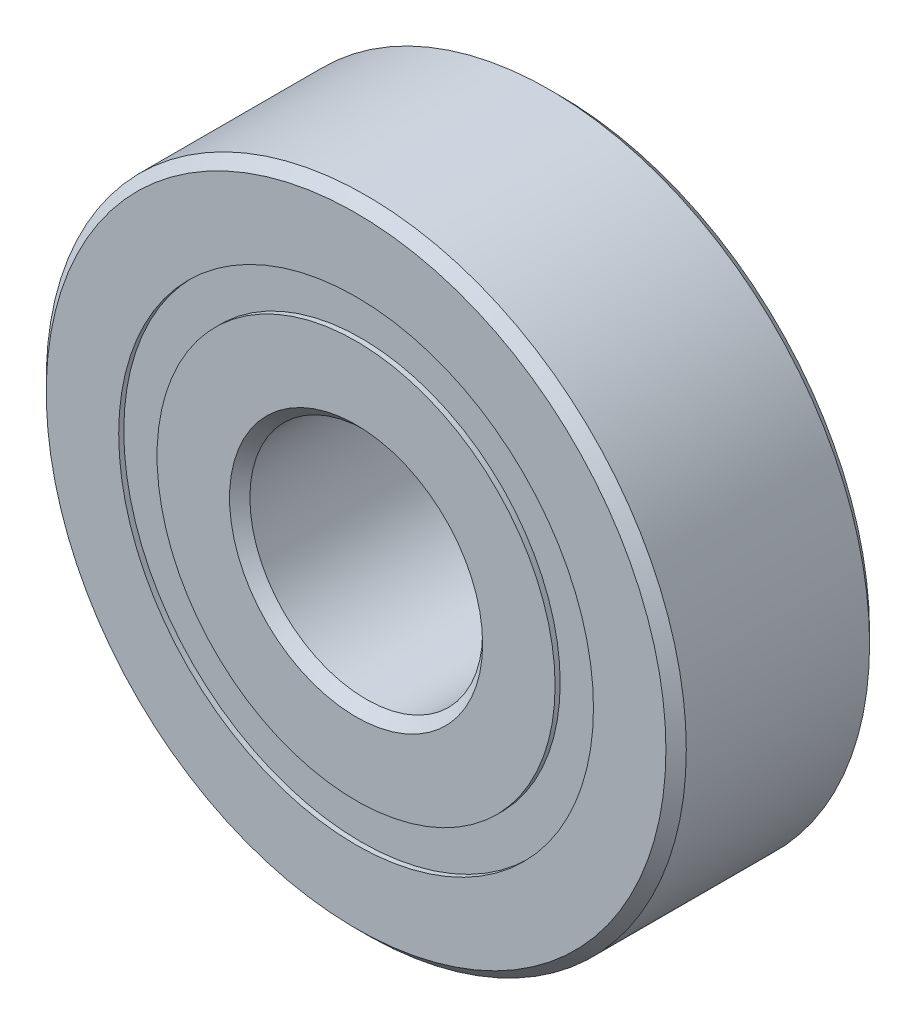
from build123d import *

# Parameters (mm, degrees)
SKETCH6_W = 1.635478413
SKETCH6_H = 1.318681318


with BuildPart() as part:
    # Sketch1 → Revolve1 (revolve)
    with BuildSketch(Plane(origin=(0, 0, 0), x_dir=(0, 0, -1), z_dir=(1, 0, 0)), mode=Mode.PRIVATE) as revolve1_sk:
        with BuildLine():
            Line((3.15, 11), (-3.15, 11))
            Line((-3.15, 11), (-3.5, 10.65))
            Line((-3.5, 10.65), (-3.5, 8.159340659))
            Line((-3.5, 8.159340659), (-1.555555556, 8.159340659))
            ThreePointArc((-1.555555556, 8.159340659), (0, 9.189521587), (1.555555556, 8.159340659))
            Line((1.555555556, 8.159340659), (3.5, 8.159340659))
            Line((3.5, 8.159340659), (3.5, 10.65))
            Line((3.5, 10.65), (3.15, 11))
        make_face()
    revolve(revolve1_sk.sketch.rotate(Axis((0, 0, 3.5), (0, 0, -1)), 90), axis=Axis((0, 0, 3.5), (0, 0, -1)))


with BuildPart() as body_2:
    # Sketch3 → Revolve3 (revolve)
    with BuildSketch(Plane(origin=(0, 0, 0), x_dir=(0, 0, -1), z_dir=(1, 0, 0)), mode=Mode.PRIVATE) as revolve3_sk:
        with BuildLine():
            Line((-3.5, 6.840659341), (-1.555555556, 6.840659341))
            ThreePointArc((-1.555555556, 6.840659341), (0, 5.810478413), (1.555555556, 6.840659341))
            Line((1.555555556, 6.840659341), (3.5, 6.840659341))
            Line((3.5, 6.840659341), (3.5, 4.35))
            Line((3.5, 4.35), (3.15, 4))
            Line((3.15, 4), (-3.15, 4))
            Line((-3.15, 4), (-3.5, 4.35))
            Line((-3.5, 4.35), (-3.5, 6.840659341))
        make_face()
    revolve(revolve3_sk.sketch.rotate(Axis((0, 0, 3.5), (0, 0, -1)), 90), axis=Axis((0, 0, 3.5), (0, 0, -1)))


with BuildPart() as body_3:
    # Sketch4 → Revolve4 (revolve)
    with BuildSketch(Plane(origin=(0, 0, 0), x_dir=(0, 0, -1), z_dir=(1, 0, 0))):
        with BuildLine():
            Line((-1.689521587, 7.5), (1.689521587, 7.5))
            ThreePointArc((1.689521587, 7.5), (0, 9.189521587), (-1.689521587, 7.5))
        make_face()
    revolve(axis=Axis((0, 7.5, 1.689521587), (0, 0, -1)))


with BuildPart() as body_4:
    # Sketch6 → Revolve5 (revolve)
    with BuildSketch(Plane(origin=(0, 0, 0), x_dir=(0, 0, -1), z_dir=(1, 0, 0)), mode=Mode.PRIVATE) as revolve5_sk:
        with Locations((-2.507260794, 7.5)):
            Rectangle(SKETCH6_W, SKETCH6_H)
        with Locations((2.507260794, 7.5)):
            Rectangle(SKETCH6_W, SKETCH6_H)
    revolve(revolve5_sk.sketch.rotate(Axis((0, 0, 3.5), (0, 0, -1)), 90), axis=Axis((0, 0, 3.5), (0, 0, -1)))


solid = Compound([part.part, body_2.part, body_3.part, body_4.part])
